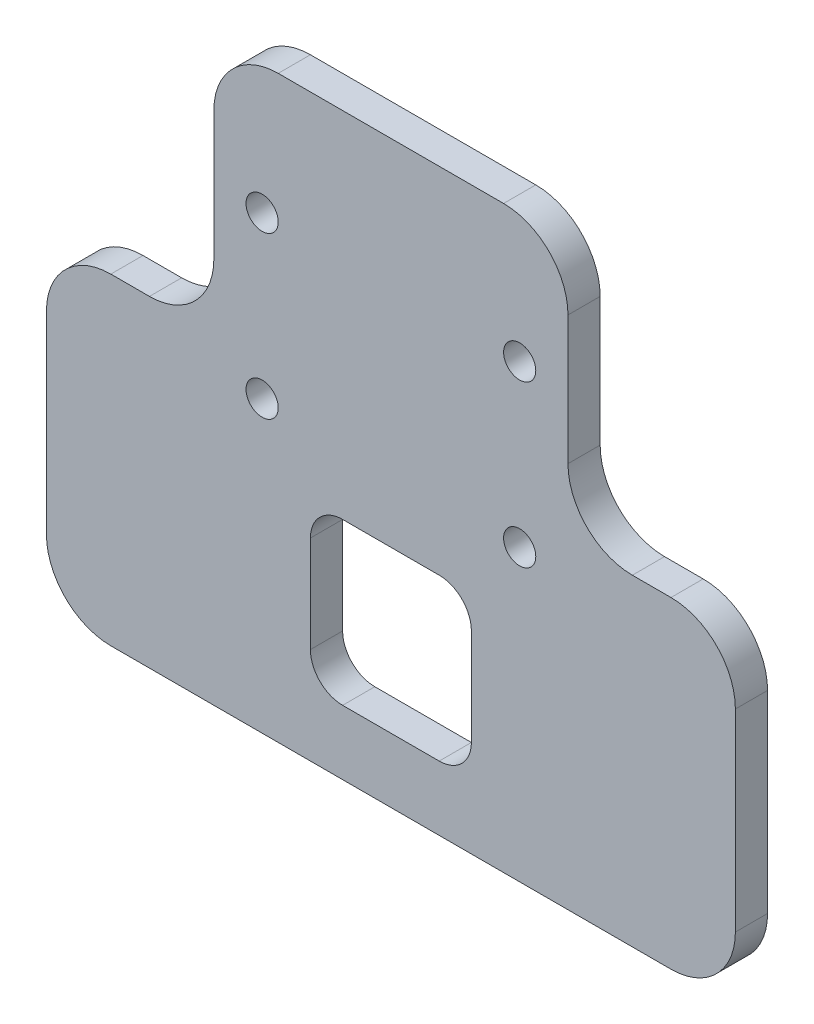
from build123d import *

# Parameters (mm, degrees)
SKETCH1_4_W         = 25
SKETCH1_4_H         = 25
SKETCH1_4_R         = 2.5
BOSS_EXTRUDE2_DEPTH = 5
FILLET3_R           = 10
FILLET4_R           = 5


with BuildPart() as part:
    # Sketch1<4> → Boss-Extrude2 (new body)
    with BuildSketch(Plane.XY):
        Polygon((-53.5, 25), (-53.5, -25), (53.5, -25), (53.5, 25), (27.5, 25), (27.5, 65), (-27.5, 65), (-27.5, 25), align=None)
        with Locations((0, -2.5)):
            Rectangle(SKETCH1_4_W, SKETCH1_4_H, mode=Mode.SUBTRACT)
        with Locations((-20, 20)):
            Circle(SKETCH1_4_R, mode=Mode.SUBTRACT)
        with Locations((-20, 45)):
            Circle(SKETCH1_4_R, mode=Mode.SUBTRACT)
        with Locations((20, 20)):
            Circle(SKETCH1_4_R, mode=Mode.SUBTRACT)
        with Locations((20, 45)):
            Circle(SKETCH1_4_R, mode=Mode.SUBTRACT)
    extrude(amount=BOSS_EXTRUDE2_DEPTH)

    # Fillet3
    fillet3_edges = [part.edges().sort_by_distance(p)[0] for p in [
        (-27.5, 65, 2.5),
        (27.5, 65, 2.5),
        (27.5, 25, 2.5),
        (53.5, 25, 2.5),
        (53.5, -25, 2.5),
        (-53.5, 25, 2.5),
        (-27.5, 25, 2.5),
        (-53.5, -25, 2.5),
    ]]
    fillet(fillet3_edges, radius=FILLET3_R)

    # Fillet4
    fillet4_edges = [part.edges().sort_by_distance(p)[0] for p in [
        (-12.5, 10, 2.5),
        (-12.5, -15, 2.5),
        (12.5, -15, 2.5),
        (12.5, 10, 2.5),
    ]]
    fillet(fillet4_edges, radius=FILLET4_R)


solid = part.part
